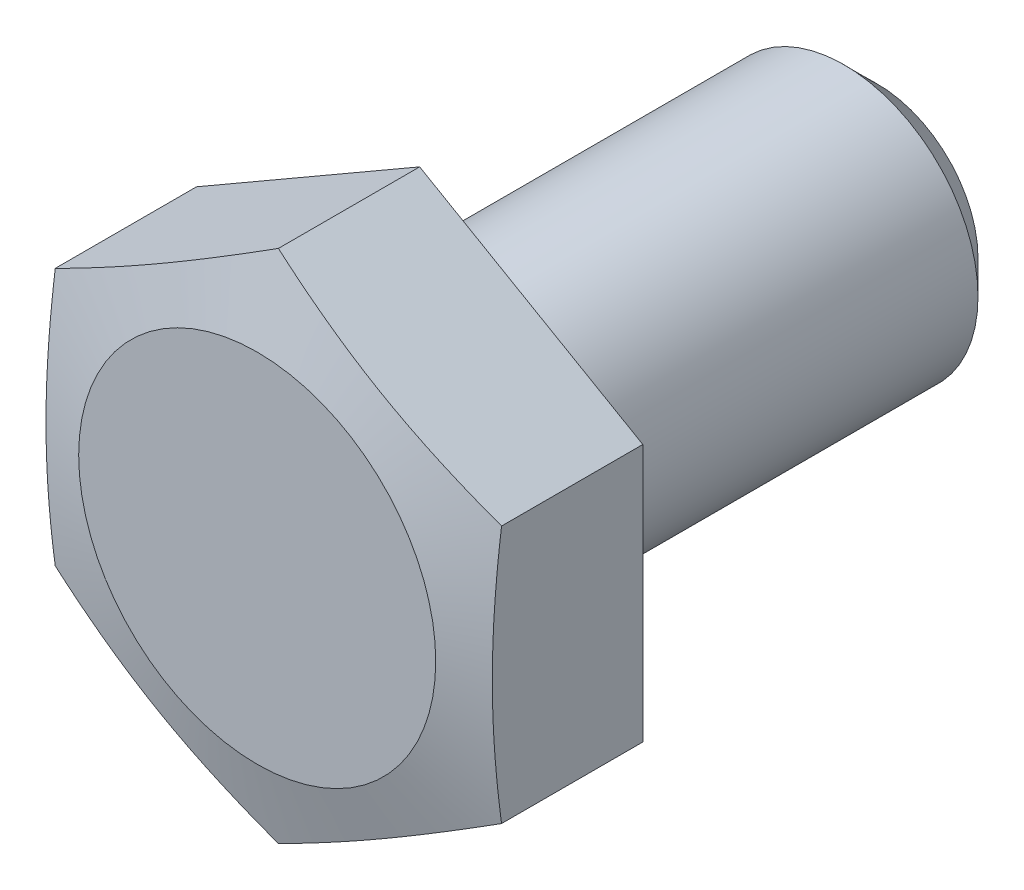
from build123d import *

# Parameters (mm, degrees)
EXTRUDE_1_DEPTH     = 3.9
SKETCH_3_R          = 3
EXTRUDE_3_DEPTH     = 10
CHAMFER_1_SIZE      = 0.75
SKETCH_2_OUTSIDE_W  = 16.13
SKETCH_2_OUTSIDE_H  = 17.678
SKETCH_2_OUTSIDE_R  = 4.5
CUT_EXTRUDE_1_DEPTH = 0.26
FILLET_1_R          = 0.1


with BuildPart() as part:
    # 草图1 → 凸台-拉伸1 (new body)
    with BuildSketch(Plane.XY):
        Polygon((0, 5.773502692), (-5, 2.886751346), (-5, -2.886751346), (0, -5.773502692), (5, -2.886751346), (5, 2.886751346), align=None)
    extrude(amount=EXTRUDE_1_DEPTH)

    # 草图3 → 凸台-拉伸3 (add)
    with BuildSketch(Plane.XY):
        Circle(SKETCH_3_R)
    extrude(amount=-EXTRUDE_3_DEPTH)

    # 草图4 → 切除-旋转1 (revolve, cut)
    with BuildSketch(Plane(origin=(0, 0, 0), x_dir=(0, 0, -1), z_dir=(1, 0, 0))):
        Polygon((-3.9, 20), (-3.9, 4), (0.387187079, 20), align=None)
    revolve(axis=Axis((0, 0, -2.242017917), (0, 0, 1)), mode=Mode.SUBTRACT)

    # 倒角1
    chamfer_1_edges = [part.edges().sort_by_distance(p)[0] for p in [
        (-3, 0, -10),
    ]]
    chamfer(chamfer_1_edges, length=CHAMFER_1_SIZE)

    # 草图2 outside → 切除-拉伸1 (cut)
    with BuildSketch(Plane.XY):
        Rectangle(SKETCH_2_OUTSIDE_W, SKETCH_2_OUTSIDE_H)
        Circle(SKETCH_2_OUTSIDE_R, mode=Mode.SUBTRACT)
    extrude(amount=CUT_EXTRUDE_1_DEPTH, mode=Mode.SUBTRACT)

    # 圆角1
    fillet_1_edges = [part.edges().sort_by_distance(p)[0] for p in [
        (-3, 0, 0),
    ]]
    fillet(fillet_1_edges, radius=FILLET_1_R)


solid = part.part
